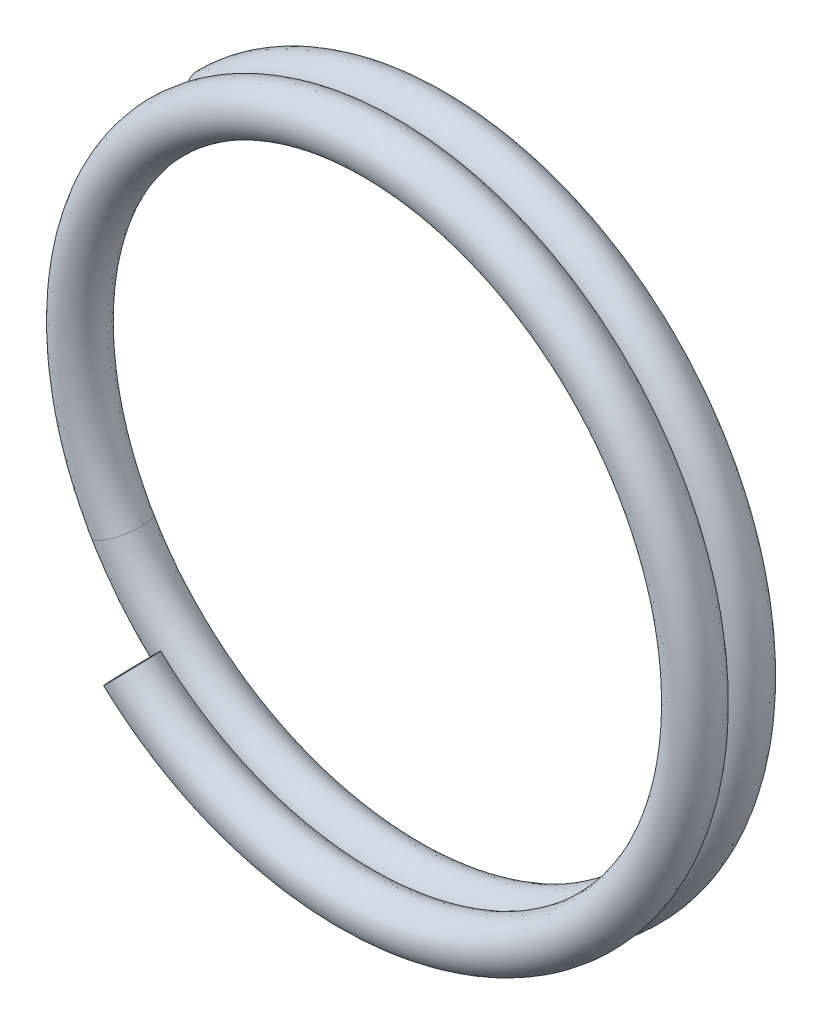
from build123d import *

# Parameters (mm, degrees)
SWEEP_1_PITCH       = 2
SWEEP_1_HEIGHT      = 3.5
SWEEP_1_RADIUS      = 13.5
SWEEP_1_START_ANGLE = 135
SKETCH_2_R          = 1


with BuildPart() as part:
    # По траектории1: sweep along a helix
    with BuildLine() as sweep_1_path:
        add(Helix(SWEEP_1_PITCH, SWEEP_1_HEIGHT, SWEEP_1_RADIUS, center=(0, 0, 0), direction=(0, 0, 1), lefthand=True, mode=Mode.PRIVATE).rotate(Axis((0, 0, 0), (0, 0, 1)), SWEEP_1_START_ANGLE))
    # Эскиз2 → По траектории1 (sweep)
    with BuildSketch(Plane(origin=(-9.545941546, 9.545941546, 0), x_dir=(0.7073032013336263, -0.7065176298382067, -0.023558864807258478), z_dir=(0.7069103064627108, 0.7069103064627189, 0.023571958628444474))):
        with Locations((-0.002308961, -0.000478563)):
            Circle(SKETCH_2_R)
    sweep(path=sweep_1_path.line, is_frenet=True)


solid = part.part
